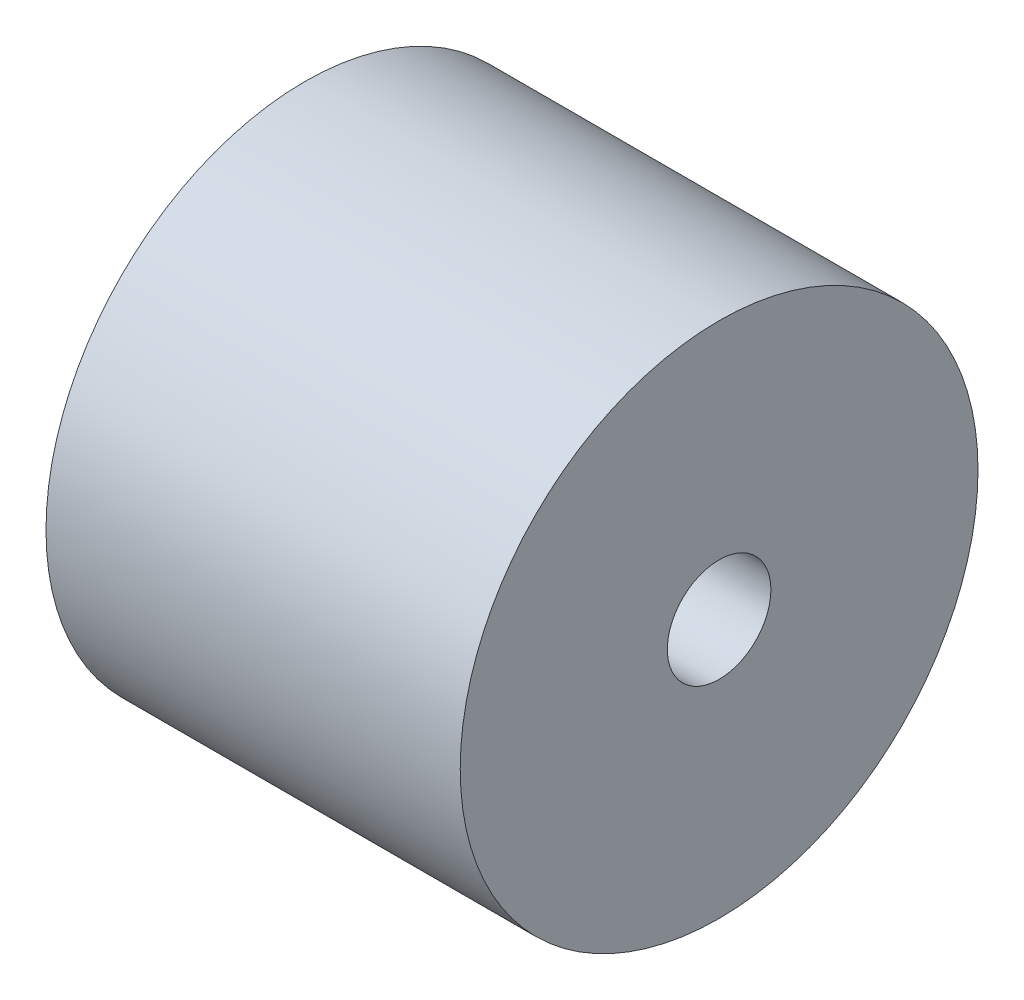
from build123d import *

# Parameters (mm, degrees)
SKETCH_1_R          = 10
EXTRUDE_1_DEPTH     = 16
SKETCH_2_R          = 2
CUT_EXTRUDE_1_DEPTH = 10


with BuildPart() as part:
    # 草图1 → 凸台-拉伸1 (new body)
    with BuildSketch(Plane(origin=(0, 0, 0), x_dir=(0, 0, -1), z_dir=(1, 0, 0))):
        Circle(SKETCH_1_R)
    extrude(amount=EXTRUDE_1_DEPTH)

    # 草图2 → 切除-拉伸1 (cut)
    with BuildSketch(Plane(origin=(16, 0, 0), x_dir=(0, 0, -1), z_dir=(1, 0, 0))):
        Circle(SKETCH_2_R)
    extrude(amount=-CUT_EXTRUDE_1_DEPTH, mode=Mode.SUBTRACT)


solid = part.part
